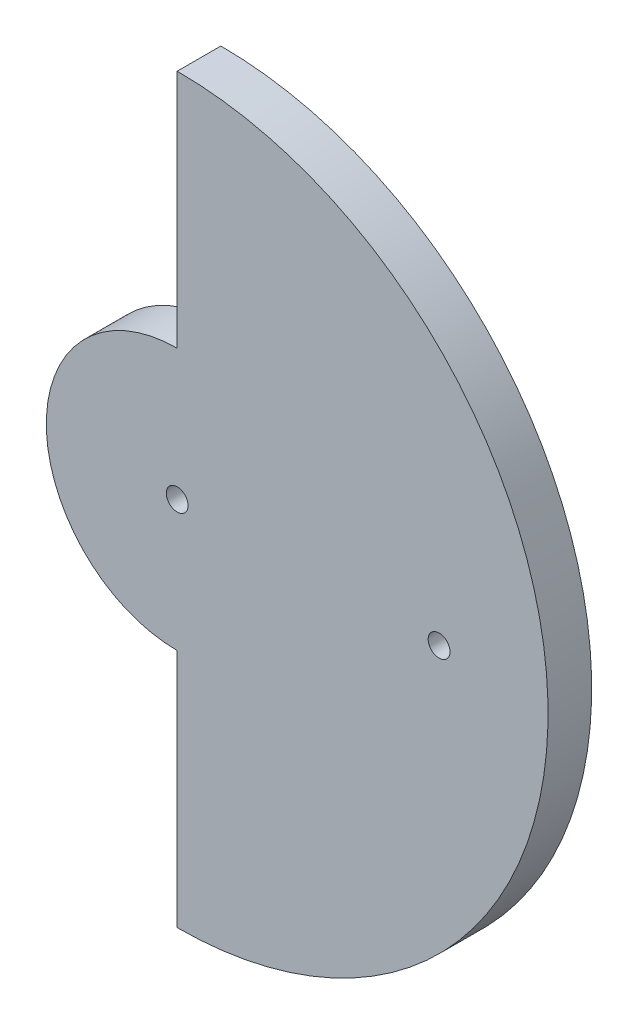
from build123d import *

# Parameters (mm, degrees)
SKETCH_1_R          = 85
EXTRUDE_1_DEPTH     = 10
SKETCH_2_R          = 2.5
CUT_EXTRUDE_1_DEPTH = 121.623380818
SKETCH_3_R          = 2.5
CUT_EXTRUDE_2_DEPTH = 121.623380818
CUT_EXTRUDE_3_DEPTH = 121.623380818
EXTRUDE_START       = -10
SKETCH_5_R          = 2.5
EXTRUDE_2_DEPTH     = 10


with BuildPart() as part:
    # 草图1 → 凸台-拉伸1 (new body)
    with BuildSketch(Plane.XY):
        Circle(SKETCH_1_R)
    extrude(amount=EXTRUDE_1_DEPTH)

    # 草图2 → 切除-拉伸1 (cut, through all)
    with BuildSketch(Plane.XY.offset(10)):
        Circle(SKETCH_2_R)
        with Locations((80, 0)):
            Circle(SKETCH_2_R)
    extrude(amount=-CUT_EXTRUDE_1_DEPTH, mode=Mode.SUBTRACT)

    # 草图3 → 切除-拉伸2 (cut, through all)
    with BuildSketch(Plane(origin=(0, 0, 0), x_dir=(-1, 0, 0), z_dir=(0, 0, -1))):
        with Locations((-60.025485081, 1.009333311)):
            Circle(SKETCH_3_R)
    extrude(amount=-CUT_EXTRUDE_2_DEPTH, mode=Mode.SUBTRACT)

    # 草图4 → 切除-拉伸3 (cut, through all)
    with BuildSketch(Plane(origin=(0, 0, 0), x_dir=(-1, 0, 0), z_dir=(0, 0, -1))):
        with BuildLine():
            ThreePointArc((85, 0), (60.104076401, 60.104076401), (0, 85))
            Line((0, 85), (0, 30))
            ThreePointArc((0, 30), (21.213203436, 21.213203436), (30, 0))
            ThreePointArc((30, 0), (21.213203436, -21.213203436), (0, -30))
            Line((0, -30), (0, -85))
            ThreePointArc((0, -85), (60.104076401, -60.104076401), (85, 0))
        make_face()
    extrude(amount=-CUT_EXTRUDE_3_DEPTH, mode=Mode.SUBTRACT)

    # 草图5 → 凸台-拉伸2 (add)
    with BuildSketch(Plane(origin=(0, 0, 0), x_dir=(-1, 0, 0), z_dir=(0, 0, -1)).offset(EXTRUDE_START)):
        with Locations((-80, 0)):
            Circle(SKETCH_5_R)
    extrude(amount=EXTRUDE_2_DEPTH)


solid = part.part
